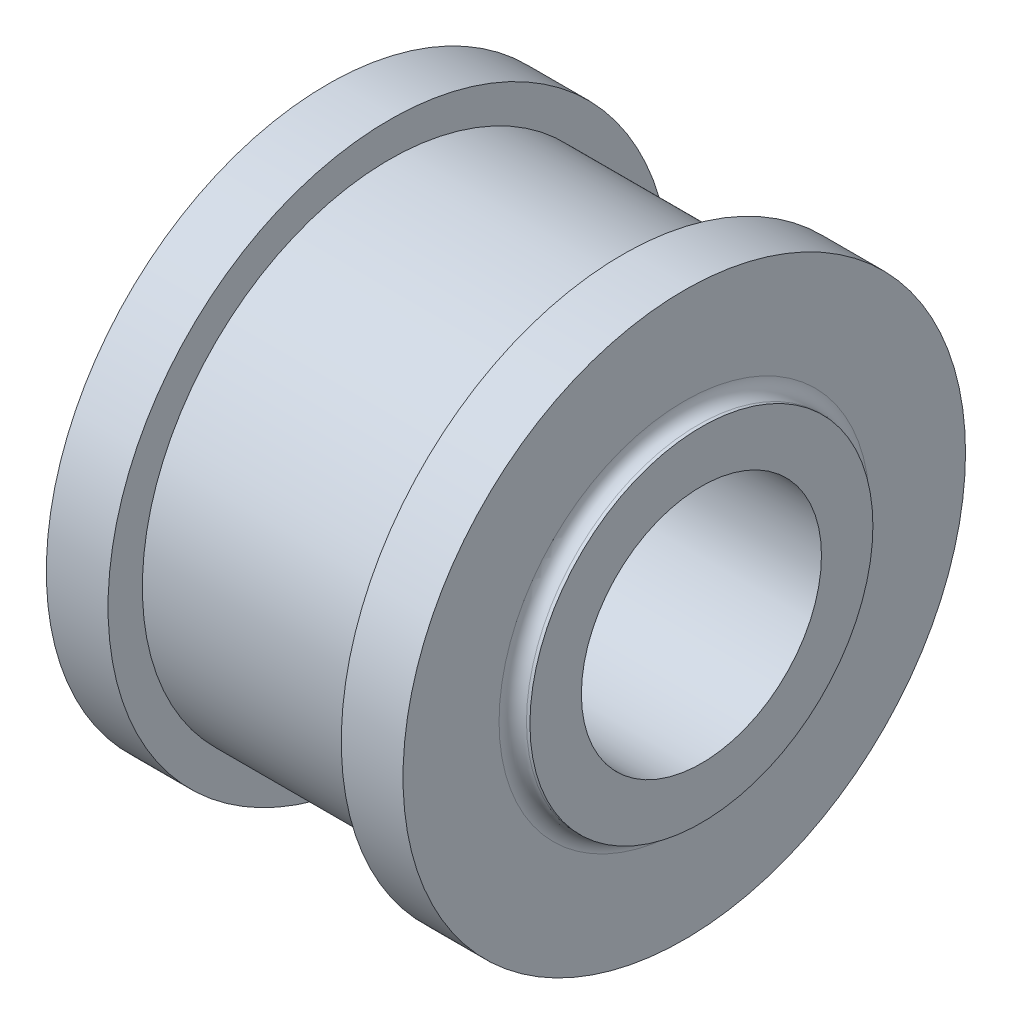
from build123d import *

# Parameters (mm, degrees)
FILLET1_R = 2


with BuildPart() as part:
    # Sketch1 → Revolve1 (revolve)
    with BuildSketch(Plane.XY, mode=Mode.PRIVATE) as revolve1_sk:
        Polygon((-42.77184466, 17.5), (14.22815534, 17.5), (14.22815534, 25), (11.72815534, 25), (11.72815534, 41), (2.72815534, 41), (2.72815534, 36), (-31.27184466, 36), (-31.27184466, 41), (-40.27184466, 41), (-40.27184466, 25), (-42.77184466, 25), align=None)
    revolve(revolve1_sk.sketch.rotate(Axis((0, 0, 0), (-1, 0, 0)), 90), axis=Axis((0, 0, 0), (-1, 0, 0)))

    # Fillet1
    fillet1_edges = [part.edges().sort_by_distance(p)[0] for p in [
        (11.72815534, 0, 25),
        (-40.27184466, 0, 25),
    ]]
    fillet(fillet1_edges, radius=FILLET1_R)


solid = part.part
